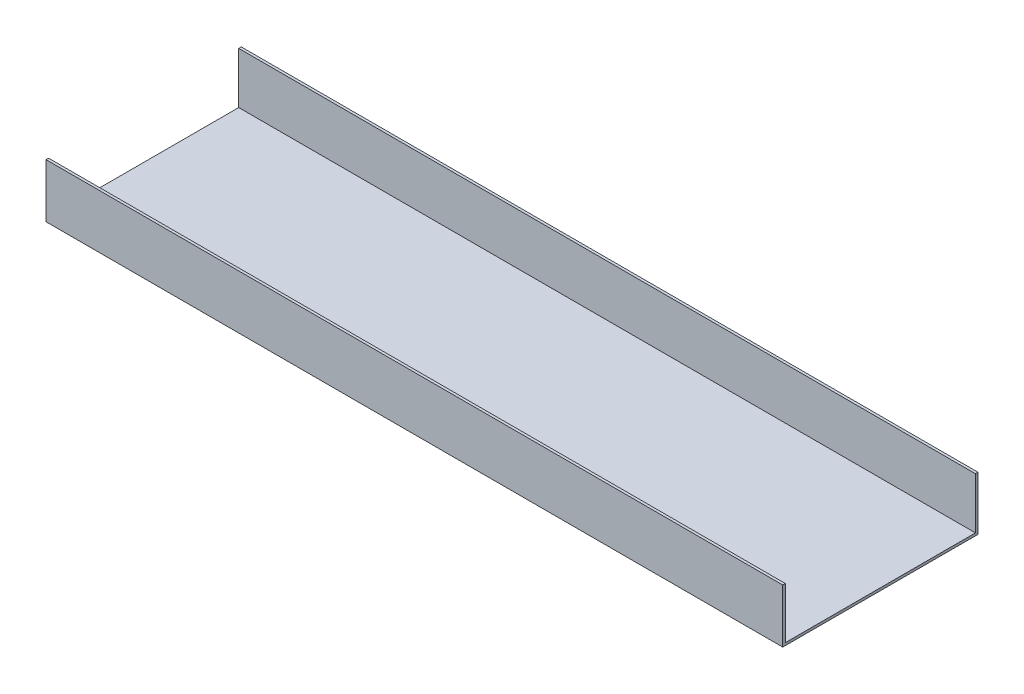
from build123d import *

# Parameters (mm, degrees)
SKETCH1_W           = 287.5
SKETCH1_H           = 76.2
BOSS_EXTRUDE1_DEPTH = 1
SKETCH2_W           = 287.5
SKETCH2_H           = 1
EXTRUDE_THIN1_DEPTH = 20
SKETCH5_W           = 287.5
SKETCH5_H           = 1
EXTRUDE_THIN2_DEPTH = 20


with BuildPart() as part:
    # Sketch1 → Boss-Extrude1 (new body)
    with BuildSketch(Plane(origin=(0, 0, 0), x_dir=(1, 0, 0), z_dir=(0, 1, 0))):
        Rectangle(SKETCH1_W, SKETCH1_H)
    extrude(amount=BOSS_EXTRUDE1_DEPTH)

    # Sketch2 → Extrude-Thin1 (add)
    with BuildSketch(Plane(origin=(0, 1, 0), x_dir=(1, 0, 0), z_dir=(0, 1, 0))):
        with Locations((0, -37.6)):
            Rectangle(SKETCH2_W, SKETCH2_H)
    extrude(amount=EXTRUDE_THIN1_DEPTH)

    # Sketch5 → Extrude-Thin2 (add)
    with BuildSketch(Plane(origin=(0, 1, 0), x_dir=(1, 0, 0), z_dir=(0, 1, 0))):
        with Locations((0, 37.6)):
            Rectangle(SKETCH5_W, SKETCH5_H)
    extrude(amount=EXTRUDE_THIN2_DEPTH)


solid = part.part
